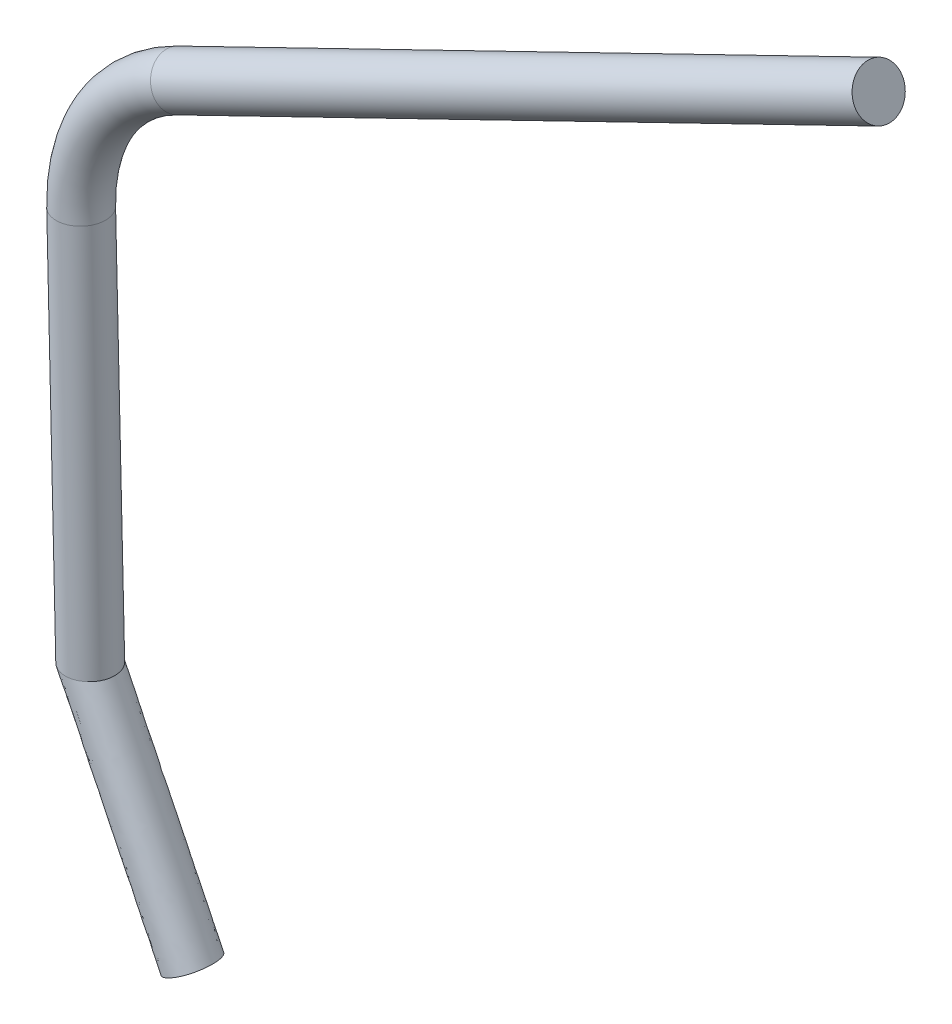
from build123d import *

# Parameters (mm, degrees)
SKETCH5_R               = 12.7
SKETCH6_R               = 12.7
BOSS_EXTRUDE3_DEPTH     = 406.4
SKETCH7_R               = 12.7
BOSS_EXTRUDE4_DEPTH     = 203.2
SKETCH9_R               = 12.065
CUT_EXTRUDE2_DEPTH      = 6.35
SKETCH10_R              = 12.7
CUT_EXTRUDE3_DEPTH      = 462.222817168
CUT_EXTRUDE3_DEPTH_BACK = 462.222817168


with BuildPart() as part:
    # Sweep1: sweep along a path in Sketch4
    with BuildLine(Plane.XY) as sweep1_path:
        ThreePointArc((-38.874671546, 79.949796199), (-75.907697444, 46.273442371), (-88.87582946, -2.072905643))
    # Sketch5 → Sweep1 (sweep)
    with BuildSketch(Plane(origin=(0, 0, 0), x_dir=(1, 0, 0), z_dir=(0, 1, 0))):
        with Locations((-88.87582946, 0)):
            Circle(SKETCH5_R)
    sweep(path=sweep1_path.line)

    # Sketch6 → Boss-Extrude3 (add)
    with BuildSketch(Plane(origin=(0, 0, 0), x_dir=(0, 0, -1), z_dir=(0.8993227918843839, 0.43728539421901275, 0))):
        with Locations(Location((0, 88.87582946, 0), (0, 0, 180))):
            Circle(SKETCH6_R)
    extrude(amount=BOSS_EXTRUDE3_DEPTH)

    # Sketch7 → Boss-Extrude4 (add)
    with BuildSketch(Plane(origin=(0, 0, 0), x_dir=(-0.9997281154099812, -0.023317273828803834, 0), z_dir=(0.023317273828803834, -0.9997281154099812, 0))):
        with Locations((88.87582946, 0)):
            Circle(SKETCH7_R)
    extrude(amount=BOSS_EXTRUDE4_DEPTH)

    # Sketch9 → Cut-Extrude2 (cut)
    with BuildSketch(Plane(origin=(0, 0, -12.7), x_dir=(-1, 0, 0), z_dir=(0, 0, -1))):
        with Locations((76.269889492, 46.494235168)):
            Circle(SKETCH9_R)
    extrude(amount=-CUT_EXTRUDE2_DEPTH, mode=Mode.SUBTRACT)

    # Sweep2: sweep along a path in Sketch11
    with BuildLine(Plane.XY) as sweep2_path:
        Line((-84.113595449, -205.217095104), (-28.578350384, -319.431089673))
    # Sketch10 → Sweep2 (sweep)
    with BuildSketch(Plane(origin=(4.738070042, -203.144753051, 0), x_dir=(-0.9997281154099812, -0.023317273828803834, 0), z_dir=(0.023317273828803834, -0.9997281154099812, 0))):
        with Locations((88.87582946, 0)):
            Circle(SKETCH10_R)
    sweep(path=sweep2_path.line)

    # Sketch12 → Cut-Extrude3 (cut, two sides: drawn at the far end of the back side and taken through both)
    with BuildSketch(Plane.XY.offset(-CUT_EXTRUDE3_DEPTH_BACK)):
        Polygon((-41.274897449, -319.727219051), (-20.504520989, -309.627861689), (-15.881803318, -319.134960295), align=None)
    extrude(amount=CUT_EXTRUDE3_DEPTH + CUT_EXTRUDE3_DEPTH_BACK, mode=Mode.SUBTRACT)


solid = part.part
